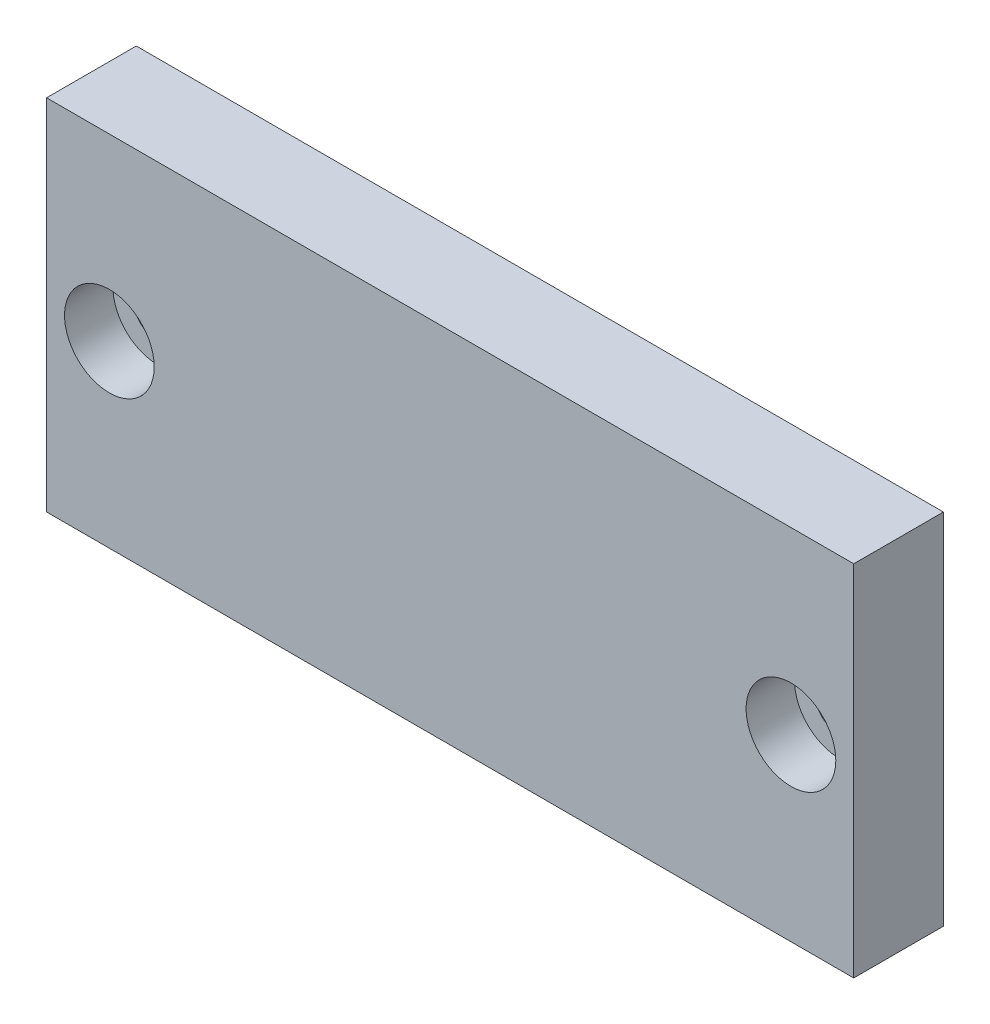
from build123d import *

# Parameters (mm, degrees)
SKETCH1_W               = 90
SKETCH1_H               = 40
BOSS_EXTRUDE1_DEPTH     = 10
CUT_EXTRUDE1_DEPTH      = 67
CUT_EXTRUDE1_DEPTH_BACK = 33
SKETCH2_R               = 2.75
CUT_EXTRUDE2_DEPTH      = 56
CUT_EXTRUDE2_DEPTH_BACK = 35
SKETCH2_4_R             = 2.75
SKETCH2_5_R             = 5
CUT_EXTRUDE3_DEPTH      = 5.4
SKETCH2_6_R             = 5
CUT_EXTRUDE4_DEPTH      = 5.4


with BuildPart() as part:
    # Sketch1 → Boss-Extrude1 (new body)
    with BuildSketch(Plane.XY):
        with Locations((-1.816720257, -1.54340836)):
            Rectangle(SKETCH1_W, SKETCH1_H)
    extrude(amount=BOSS_EXTRUDE1_DEPTH)

    # Sketch2 → Cut-Extrude1 (cut, two sides: drawn at the far end of the back side and taken through both)
    with BuildSketch(Plane.XY.offset(10).offset(-CUT_EXTRUDE1_DEPTH_BACK)):
        with Locations((-39.816720257, -1.54340836)):
            Circle(SKETCH2_R)
    extrude(amount=CUT_EXTRUDE1_DEPTH + CUT_EXTRUDE1_DEPTH_BACK, mode=Mode.SUBTRACT)

    # Sketch2<4> → Cut-Extrude2 (cut, two sides: drawn at the far end of the back side and taken through both)
    with BuildSketch(Plane.XY.offset(10).offset(-CUT_EXTRUDE2_DEPTH_BACK)):
        with Locations((36.183279743, -1.54340836)):
            Circle(SKETCH2_4_R)
    extrude(amount=CUT_EXTRUDE2_DEPTH + CUT_EXTRUDE2_DEPTH_BACK, mode=Mode.SUBTRACT)

    # Sketch2<5> → Cut-Extrude3 (cut)
    with BuildSketch(Plane.XY.offset(10)):
        with Locations((-39.816720257, -1.54340836)):
            Circle(SKETCH2_5_R)
    extrude(amount=-CUT_EXTRUDE3_DEPTH, mode=Mode.SUBTRACT)

    # Sketch2<6> → Cut-Extrude4 (cut)
    with BuildSketch(Plane.XY.offset(10)):
        with Locations((36.183279743, -1.54340836)):
            Circle(SKETCH2_6_R)
    extrude(amount=-CUT_EXTRUDE4_DEPTH, mode=Mode.SUBTRACT)


solid = part.part
